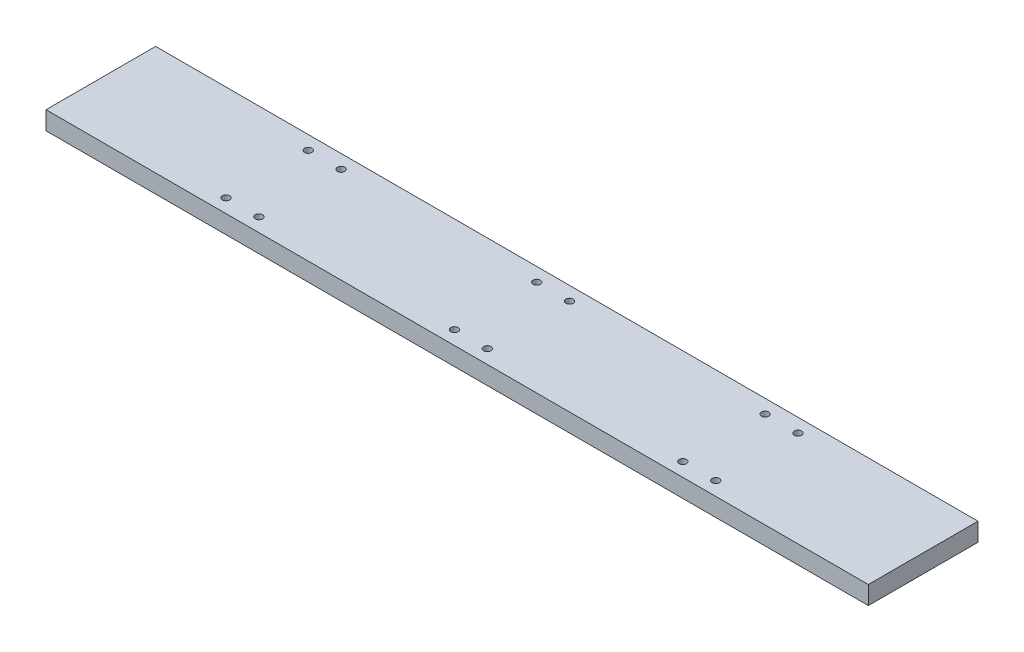
from build123d import *

# Parameters (mm, degrees)
ESBO_O1_W                = 450
ESBO_O1_H                = 60
RESSALTO_EXTRUS_O1_DEPTH = 10
ESBO_O2_R                = 2
CORTE_EXTRUS_O1_DEPTH    = 228.21135535


with BuildPart() as part:
    # Esboço1 → Ressalto-extrusão1 (new body)
    with BuildSketch(Plane(origin=(0, 0, 0), x_dir=(1, 0, 0), z_dir=(0, 1, 0))):
        Rectangle(ESBO_O1_W, ESBO_O1_H)
    extrude(amount=RESSALTO_EXTRUS_O1_DEPTH)

    # Esboço2 → Corte-extrusão1 (cut, through all)
    with BuildSketch(Plane(origin=(0, 10, 0), x_dir=(1, 0, 0), z_dir=(0, 1, 0))):
        with Locations(Location((9, 22.5, 0), (0, 0, 270))):
            Circle(ESBO_O2_R)
        with Locations(Location((116, 22.5, 0), (0, 0, 270))):
            Circle(ESBO_O2_R)
        with Locations(Location((134, 22.5, 0), (0, 0, 90))):
            Circle(ESBO_O2_R)
        with Locations(Location((134, -22.5, 0), (0, 0, 270))):
            Circle(ESBO_O2_R)
        with Locations(Location((116, -22.5, 0), (0, 0, 90))):
            Circle(ESBO_O2_R)
        with Locations(Location((9, -22.5, 0), (0, 0, 90))):
            Circle(ESBO_O2_R)
        with Locations(Location((-116, 22.5, 0), (0, 0, 90))):
            Circle(ESBO_O2_R)
        with Locations(Location((-134, 22.5, 0), (0, 0, 270))):
            Circle(ESBO_O2_R)
        with Locations(Location((-134, -22.5, 0), (0, 0, 90))):
            Circle(ESBO_O2_R)
        with Locations(Location((-116, -22.5, 0), (0, 0, 270))):
            Circle(ESBO_O2_R)
        with Locations(Location((-9, -22.5, 0), (0, 0, 270))):
            Circle(ESBO_O2_R)
        with Locations(Location((-9, 22.5, 0), (0, 0, 90))):
            Circle(ESBO_O2_R)
    extrude(amount=-CORTE_EXTRUS_O1_DEPTH, mode=Mode.SUBTRACT)


solid = part.part
